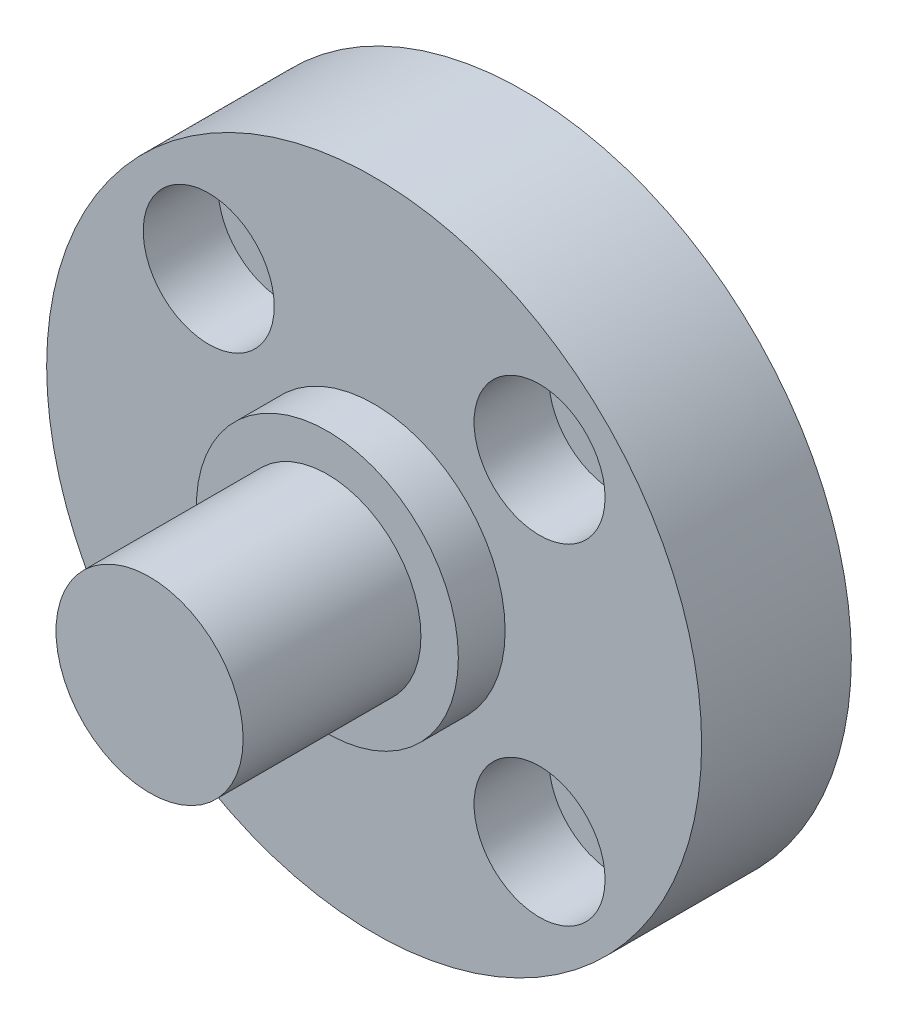
from build123d import *

# Parameters (mm, degrees)
SKETCH_1_R          = 17.5
EXTRUDE_1_DEPTH     = 8
SKETCH_2_R          = 7
EXTRUDE_2_DEPTH     = 2.5
SKETCH_3_R          = 5
EXTRUDE_3_DEPTH     = 9.5
SKETCH_4_R          = 1.6
CUT_EXTRUDE_1_DEPTH = 28.504545079
SKETCH_5_R          = 3.5
SKETCH_5_R_2        = 1.6
CUT_EXTRUDE_2_DEPTH = 4


with BuildPart() as part:
    # ｽｹｯﾁ1 → ﾎﾞｽ - 押し出し1 (new body)
    with BuildSketch(Plane.XY):
        Circle(SKETCH_1_R)
    extrude(amount=EXTRUDE_1_DEPTH)

    # ｽｹｯﾁ2 → ﾎﾞｽ - 押し出し2 (add)
    with BuildSketch(Plane.XY.offset(8)):
        Circle(SKETCH_2_R)
    extrude(amount=EXTRUDE_2_DEPTH)

    # ｽｹｯﾁ3 → ﾎﾞｽ - 押し出し3 (add)
    with BuildSketch(Plane.XY.offset(10.5)):
        Circle(SKETCH_3_R)
    extrude(amount=EXTRUDE_3_DEPTH)

    # ｽｹｯﾁ4 → ｶｯﾄ - 押し出し1 (cut, through all)
    with BuildSketch(Plane.XY.offset(8)):
        with Locations((8.838834765, 8.838834765)):
            Circle(SKETCH_4_R)
        with Locations((8.838834765, -8.838834765)):
            Circle(SKETCH_4_R)
        with Locations((-8.838834765, -8.838834765)):
            Circle(SKETCH_4_R)
        with Locations((-8.838834765, 8.838834765)):
            Circle(SKETCH_4_R)
    extrude(amount=-CUT_EXTRUDE_1_DEPTH, mode=Mode.SUBTRACT)

    # ｽｹｯﾁ5 → ｶｯﾄ - 押し出し2 (cut)
    # profile 1 of 4: a face of its own
    with BuildSketch(Plane.XY.offset(8)):
        with Locations((8.838834765, 8.838834765)):
            Circle(SKETCH_5_R)
        with Locations((8.838834765, 8.838834765)):
            Circle(SKETCH_5_R_2, mode=Mode.SUBTRACT)
    # profile 2 of 4: a face of its own
    with BuildSketch(Plane.XY.offset(8)):
        with Locations((8.838834765, -8.838834765)):
            Circle(SKETCH_5_R)
        with Locations((8.838834765, -8.838834765)):
            Circle(SKETCH_5_R_2, mode=Mode.SUBTRACT)
    # profile 3 of 4: a face of its own
    with BuildSketch(Plane.XY.offset(8)):
        with Locations((-8.838834765, -8.838834765)):
            Circle(SKETCH_5_R)
        with Locations((-8.838834765, -8.838834765)):
            Circle(SKETCH_5_R_2, mode=Mode.SUBTRACT)
    # profile 4 of 4: a face of its own
    with BuildSketch(Plane.XY.offset(8)):
        with Locations((-8.838834765, 8.838834765)):
            Circle(SKETCH_5_R)
        with Locations((-8.838834765, 8.838834765)):
            Circle(SKETCH_5_R_2, mode=Mode.SUBTRACT)
    extrude(amount=-CUT_EXTRUDE_2_DEPTH, mode=Mode.SUBTRACT)


solid = part.part
